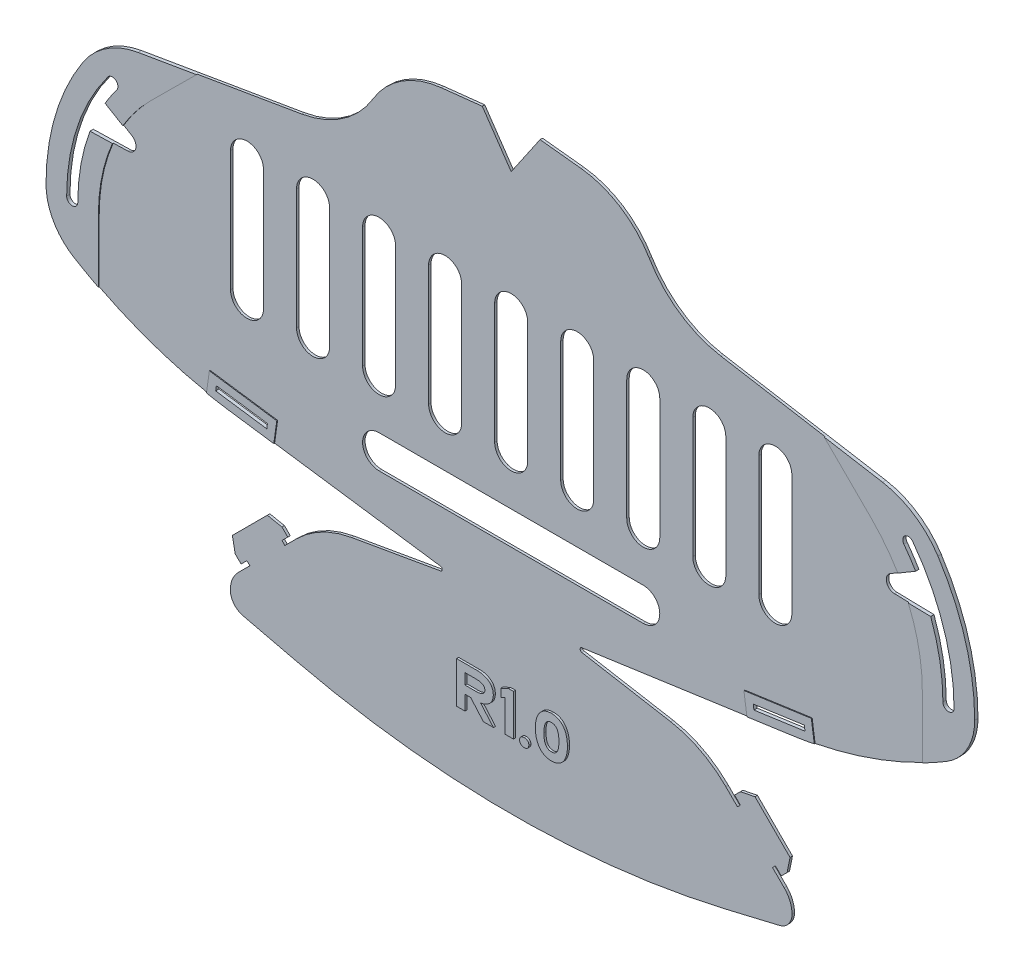
from build123d import *

# Parameters (mm, degrees)
MAIN_SHAPE_DEPTH                   = 0.6
ELASTIC_ATTACHMENT_POINTS_DEPTH    = 184.525502315
REINFORCED_ATTACHMENT_POINTS_DEPTH = 0.2
TAB_SLITS_DEPTH                    = 184.525502315
REINFORCED_TAB_SLITS_DEPTH         = 0.2
BREATHING_SLITS_DEPTH              = 184.525502315
VERSION_NUMBER_DEPTH               = 0.5
FILLET1_R                          = 0.5
CUT_EXTRUDE1_DEPTH                 = 184.526265229
CUT_EXTRUDE1_DEPTH_BACK            = 184.526265229


with BuildPart() as part:
    # Sketch1 → Main Shape (new body)
    with BuildSketch(Plane.XY):
        with BuildLine():
            Line((0, -10.235233266), (-7, 0))
            Line((-7, 0), (-16.941855461, -1.076805455))
            ThreePointArc((-16.941855461, -1.076805455), (-26.448172688, -4.42923559), (-33.461443341, -11.669600897))
            ThreePointArc((-33.461443341, -11.669600897), (-40.804108255, -19.481824954), (-50.74391922, -23.5))
            Line((-50.74391922, -23.5), (-90.180351554, -30.190874742))
            ThreePointArc((-90.180351554, -30.190874742), (-97.811505455, -33.190405434), (-103.597722286, -39))
            ThreePointArc((-103.597722286, -39), (-110.227482046, -53.35351039), (-112.5, -69))
            ThreePointArc((-112.5, -69), (-110.685143325, -75.893640703), (-105.711102551, -81))
            ThreePointArc((-105.711102551, -81), (-87.655491519, -89.524485559), (-68.266232563, -94.291935705))
            Line((-68.266232563, -94.291935705), (-14, -102))
            Line((-14, -102), (-38.626554922, -106.304973016))
            ThreePointArc((-38.626554922, -106.304973016), (-45.849449199, -108.748014338), (-52, -113.254607005))
            Line((-52, -113.254607005), (-54.828307349, -116.0831539))
            Line((-54.828307349, -116.0831539), (-55.535444073, -115.376077063))
            Line((-55.535444073, -115.376077063), (-54.121290398, -113.961803616))
            Line((-54.121290398, -113.961803616), (-55.535563846, -112.547649941))
            Line((-55.535563846, -112.547649941), (-59.071127692, -111.840692877))
            Line((-59.071127692, -111.840692877), (-67.55604974, -120.326333562))
            Line((-67.55604974, -120.326333562), (-66.848793243, -123.861837521))
            Line((-66.848793243, -123.861837521), (-65.434519796, -125.275991196))
            Line((-65.434519796, -125.275991196), (-64.020366121, -123.861717748))
            Line((-64.020366121, -123.861717748), (-63.313229397, -124.568794586))
            Line((-63.313229397, -124.568794586), (-66.141536747, -127.397341481))
            ThreePointArc((-66.141536747, -127.397341481), (-67.550417669, -129.506025763), (-68.045148042, -131.993340924))
            ThreePointArc((-68.045148042, -131.993340924), (-67.183295285, -134.473669911), (-64.9691321, -135.885159709))
            Line((-64.9691321, -135.885159709), (-52.436095294, -138.860716087))
            ThreePointArc((-52.436095294, -138.860716087), (-26.397134772, -143.459954927), (0, -145))
            ThreePointArc((0, -145), (26.397134772, -143.459954927), (52.436095294, -138.860716087))
            Line((52.436095294, -138.860716087), (64.9691321, -135.885159709))
            ThreePointArc((64.9691321, -135.885159709), (67.183295285, -134.473669911), (68.045148042, -131.993340924))
            ThreePointArc((68.045148042, -131.993340924), (67.550417669, -129.506025763), (66.141536747, -127.397341481))
            Line((66.141536747, -127.397341481), (63.313229397, -124.568794586))
            Line((63.313229397, -124.568794586), (64.020366121, -123.861717748))
            Line((64.020366121, -123.861717748), (65.434519796, -125.275991196))
            Line((65.434519796, -125.275991196), (66.848793243, -123.861837521))
            Line((66.848793243, -123.861837521), (67.55604974, -120.326333562))
            Line((67.55604974, -120.326333562), (59.071127692, -111.840692877))
            Line((59.071127692, -111.840692877), (55.535563846, -112.547649941))
            Line((55.535563846, -112.547649941), (54.121290398, -113.961803616))
            Line((54.121290398, -113.961803616), (55.535444073, -115.376077063))
            Line((55.535444073, -115.376077063), (54.828307349, -116.0831539))
            Line((54.828307349, -116.0831539), (52, -113.254607005))
            ThreePointArc((52, -113.254607005), (45.849449199, -108.748014338), (38.626554922, -106.304973016))
            Line((38.626554922, -106.304973016), (14, -102))
            Line((14, -102), (68.266232563, -94.291935705))
            ThreePointArc((68.266232563, -94.291935705), (87.655491519, -89.524485559), (105.711102551, -81))
            ThreePointArc((105.711102551, -81), (110.685143325, -75.893640703), (112.5, -69))
            ThreePointArc((112.5, -69), (110.227482046, -53.35351039), (103.597722286, -39))
            ThreePointArc((103.597722286, -39), (97.811505455, -33.190405434), (90.180351554, -30.190874742))
            Line((90.180351554, -30.190874742), (50.74391922, -23.5))
            ThreePointArc((50.74391922, -23.5), (40.804108255, -19.481824954), (33.461443341, -11.669600897))
            ThreePointArc((33.461443341, -11.669600897), (26.448172688, -4.42923559), (16.941855461, -1.076805455))
            Line((16.941855461, -1.076805455), (7, 0))
            Line((7, 0), (0, -10.235233266))
        make_face()
    extrude(amount=MAIN_SHAPE_DEPTH)

    # Sketch2 → Elastic Attachment Points (cut, through all)
    with BuildSketch(Plane.XY.offset(0.6)):
        with BuildLine():
            ThreePointArc((-97.5, -39), (-104.934164903, -53.188611699), (-107.5, -69))
            ThreePointArc((-107.5, -69), (-106.15, -70.35), (-104.8, -69))
            ThreePointArc((-104.8, -69), (-102.372719998, -54.042426667), (-95.34, -40.62))
            ThreePointArc((-95.34, -40.62), (-95.61, -38.73), (-97.5, -39))
        make_face()
        with BuildLine():
            ThreePointArc((97.5, -39), (104.934164903, -53.188611699), (107.5, -69))
            ThreePointArc((107.5, -69), (106.15, -70.35), (104.8, -69))
            ThreePointArc((104.8, -69), (102.372719998, -54.042426667), (95.34, -40.62))
            ThreePointArc((95.34, -40.62), (95.61, -38.73), (97.5, -39))
        make_face()
    extrude(amount=-ELASTIC_ATTACHMENT_POINTS_DEPTH, mode=Mode.SUBTRACT)

    # Sketch7 → Reinforced Attachment Points (add)
    # profile 1 of 2: a face of its own
    with BuildSketch(Plane.XY.offset(0.6)):
        with BuildLine():
            Line((-99.8, -69), (-99.8, -84.285345235))
            ThreePointArc((-99.8, -84.285345235), (-102.78333163, -82.692655957), (-105.711102551, -81))
            ThreePointArc((-105.711102551, -81), (-110.685143325, -75.893640703), (-112.5, -69))
            ThreePointArc((-112.5, -69), (-110.227482046, -53.35351039), (-103.597722286, -39))
            ThreePointArc((-103.597722286, -39), (-97.811505455, -33.190405434), (-90.180351554, -30.190874742))
            Line((-90.180351554, -30.190874742), (-76.046591346, -27.792908862))
            Line((-76.046591346, -27.792908862), (-87.320965779, -39))
            ThreePointArc((-87.320965779, -39), (-96.555837288, -52.754028999), (-99.8, -69))
        make_face()
        with BuildLine():
            ThreePointArc((-107.5, -69), (-106.15, -70.35), (-104.8, -69))
            ThreePointArc((-104.8, -69), (-102.372719998, -54.042426667), (-95.34, -40.62))
            ThreePointArc((-95.34, -40.62), (-95.61, -38.73), (-97.5, -39))
            ThreePointArc((-97.5, -39), (-104.934164903, -53.188611699), (-107.5, -69))
        make_face(mode=Mode.SUBTRACT)
    # profile 2 of 2: a face of its own
    with BuildSketch(Plane.XY.offset(0.6)):
        with BuildLine():
            Line((76.046591346, -27.792908862), (90.180351554, -30.190874742))
            ThreePointArc((90.180351554, -30.190874742), (97.811505455, -33.190405434), (103.597722286, -39))
            ThreePointArc((103.597722286, -39), (110.227482046, -53.35351039), (112.5, -69))
            ThreePointArc((112.5, -69), (110.685143325, -75.893640703), (105.711102551, -81))
            ThreePointArc((105.711102551, -81), (102.78333163, -82.692655957), (99.8, -84.285345235))
            Line((99.8, -84.285345235), (99.8, -69))
            ThreePointArc((99.8, -69), (96.555837288, -52.754028999), (87.320965779, -39))
            Line((87.320965779, -39), (76.046591346, -27.792908862))
        make_face()
        with BuildLine():
            ThreePointArc((104.8, -69), (106.15, -70.35), (107.5, -69))
            ThreePointArc((107.5, -69), (104.934164903, -53.188611699), (97.5, -39))
            ThreePointArc((97.5, -39), (95.61, -38.73), (95.34, -40.62))
            ThreePointArc((95.34, -40.62), (102.372719998, -54.042426667), (104.8, -69))
        make_face(mode=Mode.SUBTRACT)
    extrude(amount=REINFORCED_ATTACHMENT_POINTS_DEPTH)

    # Sketch6 → Tab Slits (cut, through all)
    with BuildSketch(Plane.XY.offset(0.6)):
        Polygon((-71.389863869, -91.82817494), (-59.014086192, -93.586050612), (-58.845330127, -92.397975955), (-71.221107805, -90.640100283), align=None)
        Polygon((71.389863869, -91.82817494), (71.221107805, -90.640100283), (58.845330127, -92.397975955), (59.014086192, -93.586050612), align=None)
    extrude(amount=-TAB_SLITS_DEPTH, mode=Mode.SUBTRACT)

    # Sketch9 → Reinforced Tab Slits (add)
    # profile 1 of 2: a face of its own
    with BuildSketch(Plane.XY.offset(0.6)):
        with BuildLine():
            Line((-57.315221871, -95.847435148), (-56.583945592, -90.699111634))
            Line((-56.583945592, -90.699111634), (-72.919972126, -88.378715747))
            Line((-72.919972126, -88.378715747), (-73.630431379, -93.38048345))
            ThreePointArc((-73.630431379, -93.38048345), (-70.954532226, -93.872700138), (-68.266232563, -94.291935705))
            Line((-68.266232563, -94.291935705), (-57.315221871, -95.847435148))
        make_face()
        Polygon((-59.014086192, -93.586050612), (-58.845330127, -92.397975955), (-71.221107805, -90.640100283), (-71.389863869, -91.82817494), align=None, mode=Mode.SUBTRACT)
    # profile 2 of 2: a face of its own
    with BuildSketch(Plane.XY.offset(0.6)):
        with BuildLine():
            Line((68.266232563, -94.291935705), (57.315221871, -95.847435148))
            Line((57.315221871, -95.847435148), (56.583945592, -90.699111634))
            Line((56.583945592, -90.699111634), (72.919972126, -88.378715747))
            Line((72.919972126, -88.378715747), (73.630431379, -93.38048345))
            ThreePointArc((73.630431379, -93.38048345), (70.954532226, -93.872700138), (68.266232563, -94.291935705))
        make_face()
        Polygon((58.845330127, -92.397975955), (71.221107805, -90.640100283), (71.389863869, -91.82817494), (59.014086192, -93.586050612), align=None, mode=Mode.SUBTRACT)
    extrude(amount=REINFORCED_TAB_SLITS_DEPTH)

    # Sketch3 → Breathing Slits (cut, through all)
    with BuildSketch(Plane.XY.offset(0.6)):
        with BuildLine():
            Line((4, -39.81), (4, -69))
            ThreePointArc((4, -69), (0, -73), (-4, -69))
            Line((-4, -69), (-4, -39.81))
            ThreePointArc((-4, -39.81), (0, -35.81), (4, -39.81))
        make_face()
        with BuildLine():
            Line((-12, -39.81), (-12, -69))
            ThreePointArc((-12, -69), (-16, -73), (-20, -69))
            Line((-20, -69), (-20, -39.81))
            ThreePointArc((-20, -39.81), (-16, -35.81), (-12, -39.81))
        make_face()
        with BuildLine():
            Line((-28, -39.81), (-28, -69))
            ThreePointArc((-28, -69), (-32, -73), (-36, -69))
            Line((-36, -69), (-36, -39.81))
            ThreePointArc((-36, -39.81), (-32, -35.81), (-28, -39.81))
        make_face()
        with BuildLine():
            Line((-32, -81), (32, -81))
            ThreePointArc((32, -81), (36, -85), (32, -89))
            Line((32, -89), (-32, -89))
            ThreePointArc((-32, -89), (-36, -85), (-32, -81))
        make_face()
        with BuildLine():
            Line((-44, -39.81), (-44, -69))
            ThreePointArc((-44, -69), (-48, -73), (-52, -69))
            Line((-52, -69), (-52, -39.81))
            ThreePointArc((-52, -39.81), (-48, -35.81), (-44, -39.81))
        make_face()
        with BuildLine():
            Line((-60, -39.81), (-60, -69))
            ThreePointArc((-60, -69), (-64, -73), (-68, -69))
            Line((-68, -69), (-68, -39.81))
            ThreePointArc((-68, -39.81), (-64, -35.81), (-60, -39.81))
        make_face()
        with BuildLine():
            Line((12, -39.81), (12, -69))
            ThreePointArc((12, -69), (16, -73), (20, -69))
            Line((20, -69), (20, -39.81))
            ThreePointArc((20, -39.81), (16, -35.81), (12, -39.81))
        make_face()
        with BuildLine():
            Line((28, -39.81), (28, -69))
            ThreePointArc((28, -69), (32, -73), (36, -69))
            Line((36, -69), (36, -39.81))
            ThreePointArc((36, -39.81), (32, -35.81), (28, -39.81))
        make_face()
        with BuildLine():
            Line((44, -39.81), (44, -69))
            ThreePointArc((44, -69), (48, -73), (52, -69))
            Line((52, -69), (52, -39.81))
            ThreePointArc((52, -39.81), (48, -35.81), (44, -39.81))
        make_face()
        with BuildLine():
            Line((60, -39.81), (60, -69))
            ThreePointArc((60, -69), (64, -73), (68, -69))
            Line((68, -69), (68, -39.81))
            ThreePointArc((68, -39.81), (64, -35.81), (60, -39.81))
        make_face()
    extrude(amount=-BREATHING_SLITS_DEPTH, mode=Mode.SUBTRACT)

    # Sketch8 → Version Number (add)
    # profile 1 of 4: a face of its own
    with BuildSketch(Plane.XY.offset(0.6)):
        with BuildLine():
            Line((-10.681741322, -128.5), (-10.681741322, -124.96031746))
            Line((-10.681741322, -124.96031746), (-9.300788941, -124.96031746))
            Line((-9.300788941, -124.96031746), (-6.237296878, -128.5))
            Line((-6.237296878, -128.5), (-3.792852433, -128.5))
            Line((-3.792852433, -128.5), (-6.903963545, -124.912698413))
            add(Edge.make_bspline(
                [(-6.903963545, -124.912698413), (-6.799255621, -124.895078178), (-6.591806562, -124.860168679), (-6.289238916, -124.783778525), (-5.998034631, -124.689774191), (-5.71963937, -124.575369689), (-5.455996956, -124.438707), (-5.203114232, -124.287011867), (-4.963905085, -124.113665535), (-4.737396987, -123.922601302), (-4.529738723, -123.712291799), (-4.349013572, -123.480132639), (-4.194520385, -123.228171256), (-4.06515396, -122.955944048), (-3.964392252, -122.663082802), (-3.891647722, -122.350564519), (-3.842716269, -122.019430997), (-3.831533225, -121.791597931), (-3.825813946, -121.675078603)],
                knots=[0, 0, 0, 0, 1.037747611, 2.056002633, 3.047618151, 4.027415449, 4.994700328, 5.948310896, 6.907893298, 7.879539827, 8.842705001, 9.791812035, 10.74932023, 11.726799765, 12.732658851, 13.770957398, 14.860013815, 16, 16, 16, 16], degree=3))
            add(Edge.make_bspline(
                [(-3.825813946, -121.675078603), (-3.834108362, -121.541655588), (-3.850214418, -121.282575418), (-3.913782195, -120.907840078), (-4.015708784, -120.561748304), (-4.148406787, -120.241647835), (-4.31685786, -119.950655953), (-4.519519441, -119.687046929), (-4.756626301, -119.452115374), (-5.027516009, -119.249401434), (-5.318313231, -119.071247685), (-5.624291923, -118.918557399), (-5.940292678, -118.785342731), (-6.26973033, -118.68110382), (-6.610120579, -118.59721552), (-6.963493077, -118.541120106), (-7.327833075, -118.504971788), (-7.574992625, -118.502628171), (-7.699852438, -118.501444225)],
                knots=[0, 0, 0, 0, 1.139146047, 2.211988333, 3.232091241, 4.208947077, 5.159219369, 6.089862227, 7.035822631, 7.995126754, 8.967722881, 9.939552469, 10.907870148, 11.888142145, 12.882111329, 13.893788514, 14.935986202, 16, 16, 16, 16], degree=3))
            Line((-7.699852438, -118.501444225), (-12.745233386, -118.5))
            Line((-12.745233386, -118.5), (-12.745233386, -128.5))
            Line((-12.745233386, -128.5), (-10.681741322, -128.5))
        make_face()
        with BuildLine():
            Line((-8.015074656, -123.03968254), (-10.681741322, -123.03968254))
            Line((-10.681741322, -123.03968254), (-10.681741322, -120.420634921))
            Line((-10.681741322, -120.420634921), (-8.015074656, -120.420634921))
            add(Edge.make_bspline(
                [(-8.015074656, -120.420634921), (-7.919926819, -120.423273955), (-7.735802761, -120.428380847), (-7.470361039, -120.445886846), (-7.226384032, -120.474922885), (-7.005006191, -120.516863016), (-6.804768231, -120.565737118), (-6.626946106, -120.627548611), (-6.471241633, -120.70018055), (-6.33950982, -120.786848917), (-6.225478581, -120.879127161), (-6.128094006, -120.978986719), (-6.045576121, -121.084329372), (-5.976211643, -121.195610284), (-5.929597408, -121.316238271), (-5.895035532, -121.440786876), (-5.872071664, -121.571677835), (-5.873483246, -121.661203771), (-5.874208928, -121.7072283)],
                knots=[0, 0, 0, 0, 1.623604347, 3.141896125, 4.536383348, 5.811767693, 6.983546784, 8.049010808, 9.018540002, 9.905887765, 10.731832844, 11.51670853, 12.279439544, 13.011719622, 13.743999701, 14.475813952, 15.216428818, 16, 16, 16, 16], degree=3))
            add(Edge.make_bspline(
                [(-5.874208928, -121.7072283), (-5.877554434, -121.792099267), (-5.884204751, -121.96080882), (-5.972641014, -122.207083613), (-6.12725207, -122.431407622), (-6.301201047, -122.599469449), (-6.469975526, -122.723887153), (-6.627123198, -122.802483063), (-6.803797796, -122.874816975), (-7.004565382, -122.930249626), (-7.226222025, -122.976369379), (-7.470221727, -123.009948633), (-7.736195205, -123.032926378), (-7.921024648, -123.038535497), (-8.016756594, -123.041440726)],
                knots=[0, 0, 0, 0, 1.077951474, 2.142790588, 3.282334172, 4.524568738, 5.209808815, 5.947525172, 6.757607031, 7.641027129, 8.598037232, 9.642830948, 10.779110197, 12, 12, 12, 12], degree=3))
            Line((-8.016756594, -123.041440726), (-8.015074656, -123.03968254))
        make_face(mode=Mode.SUBTRACT)
    # profile 2 of 4: a face of its own
    with BuildSketch(Plane.XY.offset(0.6)):
        Polygon((-0.135757119, -118.5), (-1.992899976, -119.357142857), (-1.992899976, -121.277777778), (-1.024646008, -120.833333333), (-1.024646008, -128.5), (1.038846056, -128.5), (1.038846056, -118.5), align=None)
    # profile 3 of 4: a face of its own
    with BuildSketch(Plane.XY.offset(0.6)):
        with BuildLine():
            add(Edge.make_bspline(
                [(4.777746382, -127.928571429), (4.773038613, -127.8508208), (4.76401536, -127.701798262), (4.709309728, -127.489692019), (4.61341897, -127.305144524), (4.482519912, -127.14843506), (4.319075053, -127.022343967), (4.125316491, -126.932637266), (3.903570869, -126.87962357), (3.747273626, -126.87151799), (3.665065461, -126.867254672)],
                knots=[0, 0, 0, 0, 1.07618677, 2.062698225, 3.005368429, 3.930199229, 4.866541513, 5.837812372, 6.862747201, 8, 8, 8, 8], degree=3))
            add(Edge.make_bspline(
                [(3.665065461, -126.867254672), (3.582866034, -126.871574509), (3.425841603, -126.879826632), (3.202596835, -126.932633053), (3.006586988, -127.02229948), (2.840863307, -127.148325108), (2.707610003, -127.304960175), (2.609462515, -127.489458482), (2.551783562, -127.702132614), (2.542425564, -127.85205491), (2.537529658, -127.930491081)],
                knots=[0, 0, 0, 0, 1.129891893, 2.158416905, 3.132935081, 4.071570457, 4.997198708, 5.93866095, 6.921551041, 8, 8, 8, 8], degree=3))
            add(Edge.make_bspline(
                [(2.537529658, -127.930491081), (2.542465559, -128.008906514), (2.551900001, -128.158789169), (2.608875175, -128.37107871), (2.708349821, -128.554097741), (2.840793246, -128.710355803), (3.006564252, -128.836558499), (3.202940727, -128.925398825), (3.425457922, -128.981956995), (3.582797414, -128.989686149), (3.665065461, -128.99372749)],
                knots=[0, 0, 0, 0, 1.079359842, 2.063080104, 2.996051645, 3.922461704, 4.861889873, 5.83723115, 6.869153774, 8, 8, 8, 8], degree=3))
            add(Edge.make_bspline(
                [(3.665065461, -128.99372749), (3.74734394, -128.98974627), (3.903960709, -128.982168033), (4.124969107, -128.925397533), (4.319100231, -128.83651451), (4.482582804, -128.710243336), (4.612706802, -128.553928897), (4.70981276, -128.370826239), (4.764356961, -128.158566213), (4.772343973, -128.008876774), (4.776526415, -127.930491081)],
                knots=[0, 0, 0, 0, 1.137041492, 2.164354101, 3.135444492, 4.0716128, 4.996271761, 5.929380785, 6.915708941, 8, 8, 8, 8], degree=3))
            Line((4.776526415, -127.930491081), (4.777746382, -127.928571429))
        make_face()
    # profile 4 of 4: a face of its own
    with BuildSketch(Plane.XY.offset(0.6)):
        with BuildLine():
            add(Edge.make_bspline(
                [(10.249761165, -118.5), (10.105395201, -118.505695671), (9.822640054, -118.51685121), (9.409505052, -118.5745591), (9.021662349, -118.680335178), (8.654460773, -118.819656178), (8.312185202, -119.003303471), (7.988392027, -119.221085059), (7.695381412, -119.487440084), (7.419926359, -119.785519386), (7.174063179, -120.12453761), (6.960627469, -120.500892889), (6.778664693, -120.912503383), (6.629743529, -121.360169436), (6.51419448, -121.844506854), (6.426440541, -122.364485904), (6.374886102, -122.921030718), (6.364229372, -123.303893775), (6.358750791, -123.500722112)],
                knots=[0, 0, 0, 0, 0.970159994, 1.900155169, 2.79438565, 3.665191596, 4.532301255, 5.397946305, 6.279238358, 7.185391655, 8.120220805, 9.085107467, 10.08639026, 11.138349125, 12.249459105, 13.427760297, 14.677622047, 16, 16, 16, 16], degree=3))
            add(Edge.make_bspline(
                [(6.358750791, -123.500722112), (6.364174181, -123.69832053), (6.374682808, -124.081196856), (6.426649877, -124.637697099), (6.514095767, -125.156966907), (6.630205624, -125.641884177), (6.778148287, -126.090648826), (6.960694912, -126.502814664), (7.174005217, -126.879260377), (7.420086397, -127.218032326), (7.694478134, -127.51659595), (7.98994568, -127.779877259), (8.311296923, -128.000979952), (8.654654228, -128.183632701), (9.021207282, -128.324409639), (9.410160361, -128.425104033), (9.821938682, -128.488808035), (10.104720056, -128.496221224), (10.248864131, -128.5)],
                knots=[0, 0, 0, 0, 1.327400251, 2.57203543, 3.750234214, 4.861247624, 5.917991082, 6.919186852, 7.883989653, 8.818737555, 9.724812096, 10.602616666, 11.47109776, 12.338132057, 13.208862319, 14.101698703, 15.032365954, 16, 16, 16, 16], degree=3))
            add(Edge.make_bspline(
                [(10.248864131, -128.5), (10.3930038, -128.496210687), (10.675776529, -128.488776824), (11.087616943, -128.425221319), (11.477039274, -128.323813307), (11.844400752, -128.184839888), (12.186790232, -128.000200623), (12.507836638, -127.779984633), (12.803235307, -127.516566079), (13.077645106, -127.218040576), (13.323725733, -126.879258594), (13.537018475, -126.502813072), (13.719640352, -126.090657611), (13.86727809, -125.641847927), (13.984590941, -125.157235462), (14.067033087, -124.637275213), (14.124689312, -124.081441513), (14.13259968, -123.698369528), (14.136681064, -123.500722112)],
                knots=[0, 0, 0, 0, 0.96765053, 1.898333634, 2.791185227, 3.666728435, 4.529238626, 5.397734515, 6.275554038, 7.181644014, 8.116407839, 9.081227075, 10.082439899, 11.139201358, 12.250233695, 13.427610983, 14.672766316, 16, 16, 16, 16], degree=3))
            add(Edge.make_bspline(
                [(14.136681064, -123.500722112), (14.132540234, -123.303845261), (14.12448353, -122.920787111), (14.067239551, -122.364907693), (13.984491357, -121.844238468), (13.86774172, -121.360205444), (13.719123756, -120.912494629), (13.537085938, -120.500894477), (13.323667761, -120.124539393), (13.077805167, -119.785511139), (12.802331929, -119.487469991), (12.509390721, -119.220977415), (12.185905859, -119.004075275), (11.844594211, -118.818455332), (11.476583648, -118.680915067), (11.088267015, -118.574534625), (10.675417937, -118.516562336), (10.392933106, -118.506550382), (10.248864131, -118.501444225)],
                knots=[0, 0, 0, 0, 1.322391154, 2.572941942, 3.750582404, 4.861863084, 5.913983562, 6.915420183, 7.880455081, 8.815427849, 9.721720359, 10.603147806, 11.468925845, 12.331628829, 13.207367743, 14.101735605, 15.031873656, 16, 16, 16, 16], degree=3))
            Line((10.248864131, -118.501444225), (10.249761165, -118.5))
        make_face()
        with BuildLine():
            add(Edge.make_bspline(
                [(10.249761165, -126.579365079), (10.180441617, -126.580142247), (10.044431291, -126.581667111), (9.846978054, -126.549518886), (9.660526959, -126.50001124), (9.486349664, -126.424863461), (9.322554303, -126.32888552), (9.17193876, -126.207295998), (9.033579737, -126.063513987), (8.906264679, -125.896932623), (8.792393376, -125.703005633), (8.693862387, -125.478827118), (8.613124972, -125.222713054), (8.543948214, -124.937433189), (8.492696849, -124.621763618), (8.454193284, -124.276117752), (8.428326621, -123.899148475), (8.424967345, -123.63702081), (8.423220621, -123.500722112)],
                knots=[0, 0, 0, 0, 0.820209436, 1.609314487, 2.362064528, 3.101854642, 3.850272983, 4.605479342, 5.3882482, 6.210255141, 7.084711649, 8.047345167, 9.106040688, 10.263495908, 11.523832392, 12.893430008, 14.384674726, 16, 16, 16, 16], degree=3))
            add(Edge.make_bspline(
                [(8.423220621, -123.500722112), (8.424974232, -123.364424703), (8.428346752, -123.102299516), (8.454122396, -122.725313211), (8.49301537, -122.378974061), (8.543311654, -122.063111109), (8.613529077, -121.778059679), (8.693832109, -121.522619394), (8.792362269, -121.298401339), (8.906396928, -121.104640769), (9.032787233, -120.937923887), (9.172749718, -120.796456824), (9.32247047, -120.674830172), (9.486310354, -120.578630118), (9.660956374, -120.50465551), (9.846323921, -120.450210023), (10.04446763, -120.423926373), (10.179910903, -120.422146526), (10.248864131, -120.421240419)],
                knots=[0, 0, 0, 0, 1.616177311, 3.108208617, 4.478528655, 5.748482895, 6.897727805, 7.956981757, 8.920123036, 9.795040793, 10.617481319, 11.394165711, 12.149770419, 12.898583529, 13.63876386, 14.394368568, 15.182584207, 16, 16, 16, 16], degree=3))
            add(Edge.make_bspline(
                [(10.248864131, -120.421240419), (10.317815766, -120.422149219), (10.45325591, -120.423934355), (10.651422131, -120.450179948), (10.836708719, -120.504762296), (11.011042065, -120.577982734), (11.1732674, -120.675595023), (11.322737158, -120.796360516), (11.462637405, -120.937948802), (11.589001717, -121.104645093), (11.703226454, -121.298351736), (11.801011735, -121.523063414), (11.884971593, -121.777554553), (11.954160692, -122.063195246), (12.004790371, -122.378948588), (12.043582486, -122.725320897), (12.069388149, -123.102297333), (12.072756301, -123.364423957), (12.07450764, -123.500722112)],
                knots=[0, 0, 0, 0, 0.817669415, 1.606129616, 2.361968767, 3.102378757, 3.843623451, 4.599462602, 5.376387978, 6.199083685, 7.074272906, 8.037713021, 9.100132017, 10.249733507, 11.520081779, 12.89082699, 14.383321233, 16, 16, 16, 16], degree=3))
            add(Edge.make_bspline(
                [(12.07450764, -123.500722112), (12.072763187, -123.637021556), (12.069408279, -123.899150658), (12.043511603, -124.276110066), (12.005108653, -124.621789015), (11.953525434, -124.937349474), (11.88538357, -125.223220708), (11.800982057, -125.478383327), (11.703195202, -125.703055181), (11.589134023, -125.896928348), (11.461844881, -126.063488884), (11.323548791, -126.207393621), (11.173184701, -126.328120602), (11.011003474, -126.425517476), (10.837138224, -126.499891817), (10.650768886, -126.549600883), (10.453579257, -126.581404352), (10.317880722, -126.580608552), (10.248864131, -126.580203806)],
                knots=[0, 0, 0, 0, 1.616177474, 3.108208932, 4.478529109, 5.739530511, 6.897596372, 7.959685938, 8.922827315, 9.797745161, 10.620185771, 11.403367596, 12.15897238, 12.899987232, 13.640167639, 14.39331481, 15.182836171, 16, 16, 16, 16], degree=3))
            Line((10.248864131, -126.580203806), (10.249761165, -126.579365079))
        make_face(mode=Mode.SUBTRACT)
    extrude(amount=VERSION_NUMBER_DEPTH)

    # Fillet1
    fillet1_edges = [part.edges().sort_by_distance(p)[0] for p in [
        (14, -102, 0.3),
        (-14, -102, 0.3),
    ]]
    fillet(fillet1_edges, radius=FILLET1_R)

    # Sketch12 → Cut-Extrude1 (cut, two sides: drawn at the far end of the back side and taken through both)
    with BuildSketch(Plane.XY.offset(0.8).offset(-CUT_EXTRUDE1_DEPTH_BACK)):
        with BuildLine():
            Line((-98.182869077, -44.8713), (-91.873075253, -48.613590691))
            ThreePointArc((-91.873075253, -48.613590691), (-90.958522115, -50.840325527), (-92.846883729, -52.333257504))
            Line((-92.846883729, -52.333257504), (-101.844457924, -52.542203931))
            ThreePointArc((-101.844457924, -52.542203931), (-100.186324227, -48.624335004), (-98.182869077, -44.8713))
        make_face()
        with BuildLine():
            Line((101.844457924, -52.542203931), (92.846883729, -52.333257504))
            ThreePointArc((92.846883729, -52.333257504), (90.958522115, -50.840325527), (91.873075253, -48.613590691))
            Line((91.873075253, -48.613590691), (98.182869077, -44.8713))
            ThreePointArc((98.182869077, -44.8713), (100.186324227, -48.624335004), (101.844457924, -52.542203931))
        make_face()
    extrude(amount=CUT_EXTRUDE1_DEPTH + CUT_EXTRUDE1_DEPTH_BACK, mode=Mode.SUBTRACT)


solid = part.part
